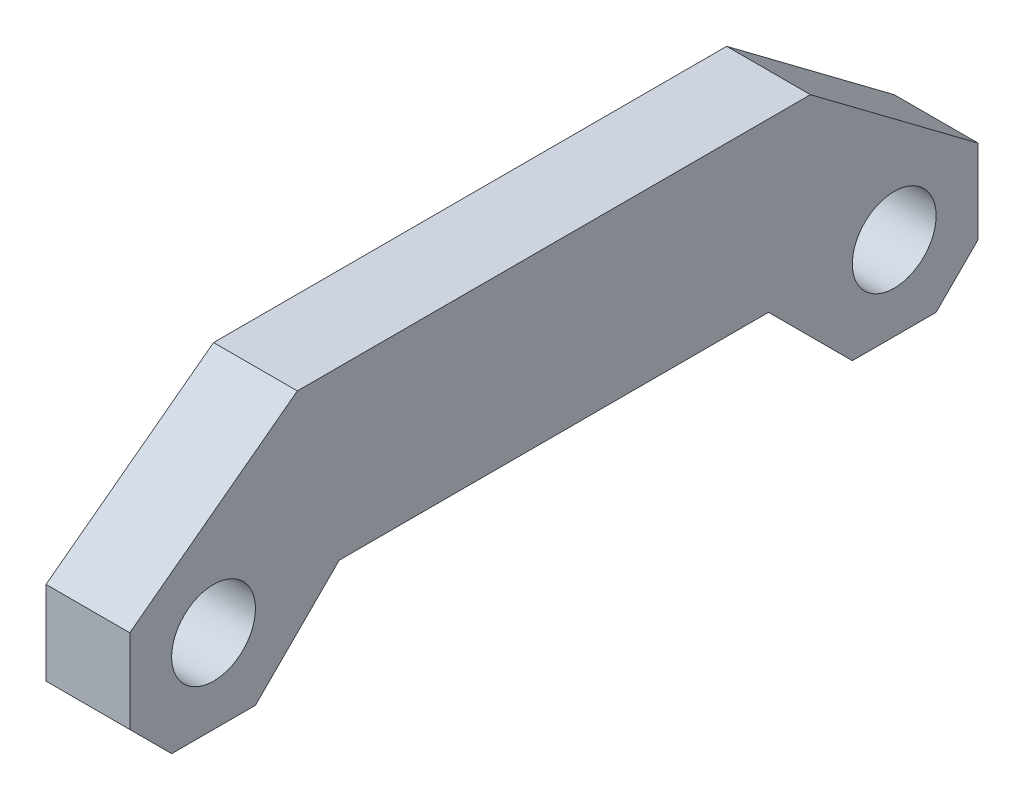
from build123d import *

# Parameters (mm, degrees)
SKETCH1_W          = 257.175
SKETCH1_H          = 76.2
SKETCH1_R          = 12.7
EXTRUDE1_DEPTH     = 12.7
CUT_EXTRUDE2_REACH = 142.572


with BuildPart() as part:
    # Sketch1 → Extrude1 (new, symmetric)
    with BuildSketch(Plane(origin=(0, 0, 0), x_dir=(0, 0, -1), z_dir=(1, 0, 0))):
        with Locations((0, 12.7)):
            Rectangle(SKETCH1_W, SKETCH1_H)
        with Locations((-103.1875, 0)):
            Circle(SKETCH1_R, mode=Mode.SUBTRACT)
        with Locations((103.1875, 0)):
            Circle(SKETCH1_R, mode=Mode.SUBTRACT)
    extrude(amount=EXTRUDE1_DEPTH, both=True)

    # Sketch2 → Cut-Extrude2 (cut, up to next)
    with BuildSketch(Plane(origin=(12.7, 0, 0), x_dir=(0, 0, -1), z_dir=(1, 0, 0)), mode=Mode.PRIVATE) as cut_extrude2_sk1:
        Polygon((-90.4875, -25.4), (-65.0875, 0), (65.0875, 0), (90.4875, -25.4), align=None)
    cut_extrude2_tool1 = extrude(cut_extrude2_sk1.sketch, amount=-CUT_EXTRUDE2_REACH, mode=Mode.PRIVATE) & part.part
    # Sketch2 → Cut-Extrude2 (cut, up to next)
    with BuildSketch(Plane(origin=(12.7, 0, 0), x_dir=(0, 0, -1), z_dir=(1, 0, 0)), mode=Mode.PRIVATE) as cut_extrude2_sk2:
        Polygon((-128.5875, 50.8), (-128.5875, 12.7), (-77.7875, 50.8), align=None)
    cut_extrude2_tool2 = extrude(cut_extrude2_sk2.sketch, amount=-CUT_EXTRUDE2_REACH, mode=Mode.PRIVATE) & part.part
    # Sketch2 → Cut-Extrude2 (cut, up to next)
    with BuildSketch(Plane(origin=(12.7, 0, 0), x_dir=(0, 0, -1), z_dir=(1, 0, 0)), mode=Mode.PRIVATE) as cut_extrude2_sk3:
        Polygon((77.7875, 50.8), (128.5875, 50.8), (128.5875, 12.7), align=None)
    cut_extrude2_tool3 = extrude(cut_extrude2_sk3.sketch, amount=-CUT_EXTRUDE2_REACH, mode=Mode.PRIVATE) & part.part
    # Sketch2 → Cut-Extrude2 (cut, up to next)
    with BuildSketch(Plane(origin=(12.7, 0, 0), x_dir=(0, 0, -1), z_dir=(1, 0, 0)), mode=Mode.PRIVATE) as cut_extrude2_sk4:
        Polygon((-128.5875, -25.4), (-128.5875, -12.7), (-115.8875, -25.4), align=None)
    cut_extrude2_tool4 = extrude(cut_extrude2_sk4.sketch, amount=-CUT_EXTRUDE2_REACH, mode=Mode.PRIVATE) & part.part
    # Sketch2 → Cut-Extrude2 (cut, up to next)
    with BuildSketch(Plane(origin=(12.7, 0, 0), x_dir=(0, 0, -1), z_dir=(1, 0, 0)), mode=Mode.PRIVATE) as cut_extrude2_sk5:
        Polygon((128.5875, -12.7), (128.5875, -25.4), (115.8875, -25.4), align=None)
    cut_extrude2_tool5 = extrude(cut_extrude2_sk5.sketch, amount=-CUT_EXTRUDE2_REACH, mode=Mode.PRIVATE) & part.part
    add(cut_extrude2_tool1.solids().sort_by_distance((12.7, -13.391156, 0))[0], mode=Mode.SUBTRACT)
    add(cut_extrude2_tool2.solids().sort_by_distance((12.7, 38.1, 111.654167))[0], mode=Mode.SUBTRACT)
    add(cut_extrude2_tool3.solids().sort_by_distance((12.7, 38.1, -111.654167))[0], mode=Mode.SUBTRACT)
    add(cut_extrude2_tool4.solids().sort_by_distance((12.7, -21.166667, 124.354167))[0], mode=Mode.SUBTRACT)
    add(cut_extrude2_tool5.solids().sort_by_distance((12.7, -21.166667, -124.354167))[0], mode=Mode.SUBTRACT)


solid = part.part
